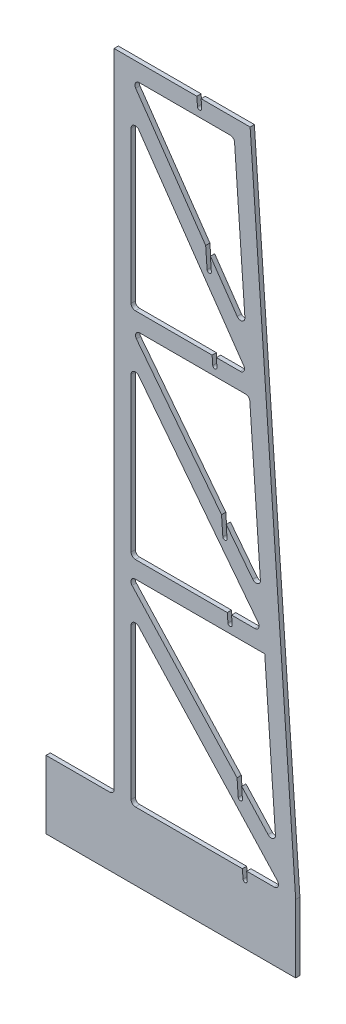
from build123d import *

# Parameters (mm, degrees)
BOSS_EXTRUDE2_DEPTH = 1.5875


with BuildPart() as part:
    # Sketch2 → Boss-Extrude2 (new body)
    with BuildSketch(Plane.XY):
        with BuildLine():
            Line((0, 0), (22.726605384, 0))
            Line((22.726605384, 0), (25.4, 0))
            Line((25.4, 0), (93.218, 0))
            Line((93.218, 0), (93.218, 25.4))
            Line((93.218, 25.4), (76.2, 266.7))
            Line((76.2, 266.7), (57.898403378, 266.7))
            Line((57.898403378, 266.7), (58.118386132, 263.580841559))
            ThreePointArc((58.118386132, 263.580841559), (57.382444397, 262.733216707), (56.534819546, 263.469158441))
            Line((56.534819546, 263.469158441), (56.306960194, 266.7))
            Line((56.306960194, 266.7), (25.4, 266.7))
            Line((25.4, 266.7), (25.4, 26.9875))
            ThreePointArc((25.4, 26.9875), (24.935032015, 25.864967985), (23.8125, 25.4))
            Line((23.8125, 25.4), (0, 25.4))
            Line((0, 25.4), (0, 0))
        make_face()
        with BuildLine():
            Line((34.777339087, 260.35), (68.802586709, 260.35))
            ThreePointArc((68.802586709, 260.35), (69.884912746, 259.92384689), (70.386153295, 258.874183117))
            Line((70.386153295, 258.874183117), (74.25178186, 204.063031823))
            ThreePointArc((74.25178186, 204.063031823), (73.194086522, 202.453478324), (71.362368826, 203.048618789))
            Line((71.362368826, 203.048618789), (61.367737995, 217.506379541))
            Line((61.367737995, 217.506379541), (61.713239359, 212.607479611))
            ThreePointArc((61.713239359, 212.607479611), (60.966778576, 211.777785767), (60.128358495, 212.514431775))
            Line((60.128358495, 212.514431775), (59.595490006, 220.070029749))
            Line((59.595490006, 220.070029749), (33.471492639, 257.859770083))
            ThreePointArc((33.471492639, 257.859770083), (33.371415904, 259.499749112), (34.777339087, 260.35))
        make_face(mode=Mode.SUBTRACT)
        with BuildLine():
            Line((81.657258841, 99.06), (85.652951472, 42.404656719))
            ThreePointArc((85.652951472, 42.404656719), (84.6981432, 40.835297632), (82.901413184, 41.217799964))
            Line((82.901413184, 41.217799964), (73.045756556, 51.924096733))
            Line((73.045756556, 51.924096733), (73.333849522, 47.839196468))
            ThreePointArc((73.333849522, 47.839196468), (72.597907788, 46.991571616), (71.750282937, 47.727513351))
            Line((71.750282937, 47.727513351), (71.322271249, 53.796335779))
            Line((71.322271249, 53.796335779), (32.106028298, 96.397326362))
            ThreePointArc((32.106028298, 96.397326362), (31.820212808, 98.110198243), (33.274, 99.06))
            Line((33.274, 99.06), (81.657258841, 99.06))
        make_face(mode=Mode.SUBTRACT)
        with BuildLine():
            Line((31.75, 26.9875), (31.75, 83.339802581))
            ThreePointArc((31.75, 83.339802581), (32.76043797, 84.818706115), (34.505471702, 84.414976219))
            Line((34.505471702, 84.414976219), (86.380452981, 28.062673638))
            ThreePointArc((86.380452981, 28.062673638), (86.666268471, 26.349801757), (85.212481279, 25.4))
            Line((85.212481279, 25.4), (74.916403378, 25.4))
            Line((74.916403378, 25.4), (75.136386132, 22.280841559))
            ThreePointArc((75.136386132, 22.280841559), (74.400444397, 21.433216707), (73.552819546, 22.169158441))
            Line((73.552819546, 22.169158441), (73.324960194, 25.4))
            Line((73.324960194, 25.4), (33.3375, 25.4))
            ThreePointArc((33.3375, 25.4), (32.214967985, 25.864967985), (31.75, 26.9875))
        make_face(mode=Mode.SUBTRACT)
        with BuildLine():
            Line((79.221902862, 107.970834504), (34.591603741, 165.475243131))
            ThreePointArc((34.591603741, 165.475243131), (32.823074805, 166.003748488), (31.75, 164.501908627))
            Line((31.75, 164.501908627), (31.75, 106.9975))
            ThreePointArc((31.75, 106.9975), (32.214967985, 105.874967985), (33.3375, 105.41))
            Line((33.3375, 105.41), (67.682149668, 105.41))
            Line((67.682149668, 105.41), (67.91000902, 102.179158441))
            ThreePointArc((67.91000902, 102.179158441), (68.757633871, 101.443216707), (69.493575605, 102.290841559))
            Line((69.493575605, 102.290841559), (69.273592852, 105.41))
            Line((69.273592852, 105.41), (77.967799122, 105.41))
            ThreePointArc((77.967799122, 105.41), (79.393513815, 106.299292393), (79.221902862, 107.970834504))
        make_face(mode=Mode.SUBTRACT)
        with BuildLine():
            Line((34.991617614, 179.493333333), (74.505109516, 179.493333333))
            ThreePointArc((74.505109516, 179.493333333), (75.587435553, 179.067180223), (76.088676102, 178.01751645))
            Line((76.088676102, 178.01751645), (80.038176523, 122.017137338))
            ThreePointArc((80.038176523, 122.017137338), (79.021577531, 120.42265147), (77.200506197, 120.932119716))
            Line((77.200506197, 120.932119716), (67.277133916, 133.717999844))
            Line((67.277133916, 133.717999844), (67.59537819, 129.205581031))
            ThreePointArc((67.59537819, 129.205581031), (66.859436456, 128.357956179), (66.011811604, 129.093897913))
            Line((66.011811604, 129.093897913), (65.526620874, 135.973467973))
            Line((65.526620874, 135.973467973), (33.737513874, 176.932498829))
            ThreePointArc((33.737513874, 176.932498829), (33.56590292, 178.60404094), (34.991617614, 179.493333333))
        make_face(mode=Mode.SUBTRACT)
        with BuildLine():
            Line((73.81525743, 188.333563251), (34.643346448, 244.997798955))
            ThreePointArc((34.643346448, 244.997798955), (32.86467603, 245.610520701), (31.75, 244.095069038))
            Line((31.75, 244.095069038), (31.75, 187.430833333))
            ThreePointArc((31.75, 187.430833333), (32.214967985, 186.308301318), (33.3375, 185.843333333))
            Line((33.3375, 185.843333333), (62.009483001, 185.843333333))
            Line((62.009483001, 185.843333333), (62.237342353, 182.612491775))
            ThreePointArc((62.237342353, 182.612491775), (63.084967204, 181.87655004), (63.820908939, 182.724174892))
            Line((63.820908939, 182.724174892), (63.600926185, 185.843333333))
            Line((63.600926185, 185.843333333), (72.509410982, 185.843333333))
            ThreePointArc((72.509410982, 185.843333333), (73.915334165, 186.693584221), (73.81525743, 188.333563251))
        make_face(mode=Mode.SUBTRACT)
    extrude(amount=BOSS_EXTRUDE2_DEPTH)


solid = part.part
